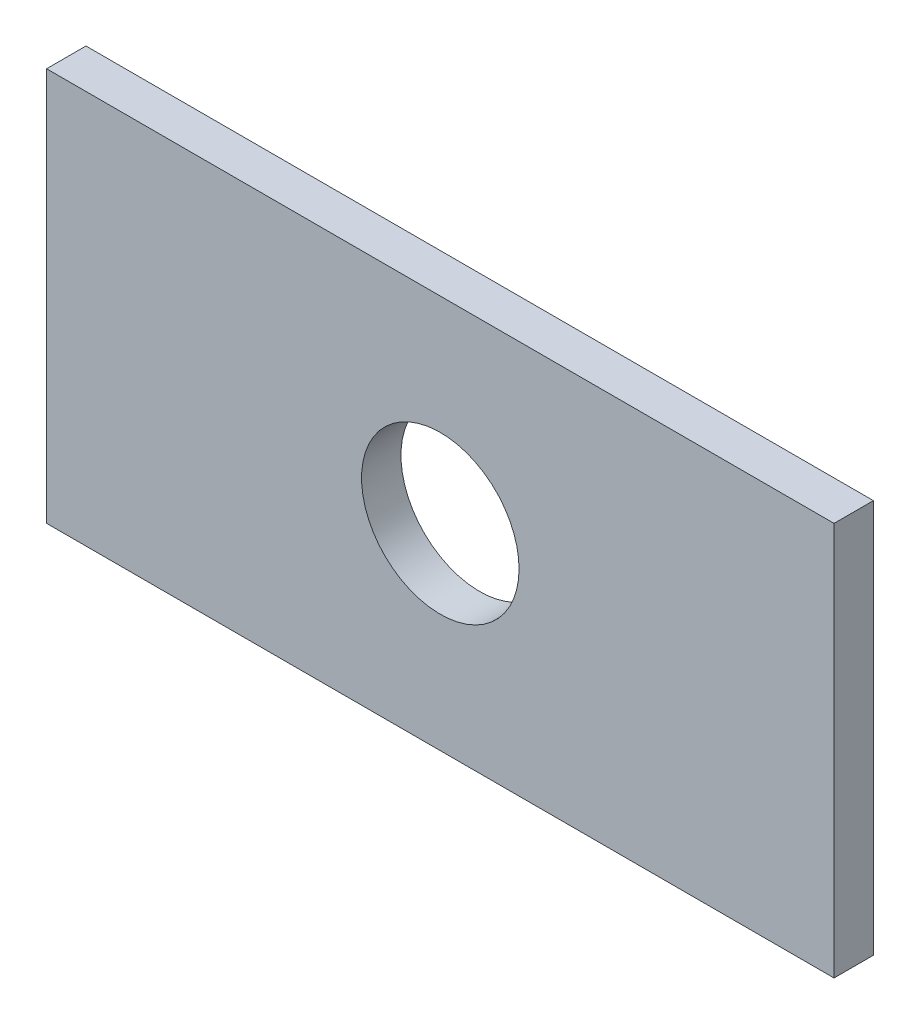
from build123d import *

# Parameters (mm, degrees)
SKETCH_2_W      = 200
SKETCH_2_H      = 100
SKETCH_2_R      = 20
EXTRUDE_1_DEPTH = 10


with BuildPart() as part:
    # Эскиз2 → Бобышка-Вытянуть1 (new body)
    with BuildSketch(Plane.XY):
        Rectangle(SKETCH_2_W, SKETCH_2_H)
        Circle(SKETCH_2_R, mode=Mode.SUBTRACT)
    extrude(amount=EXTRUDE_1_DEPTH)


solid = part.part
